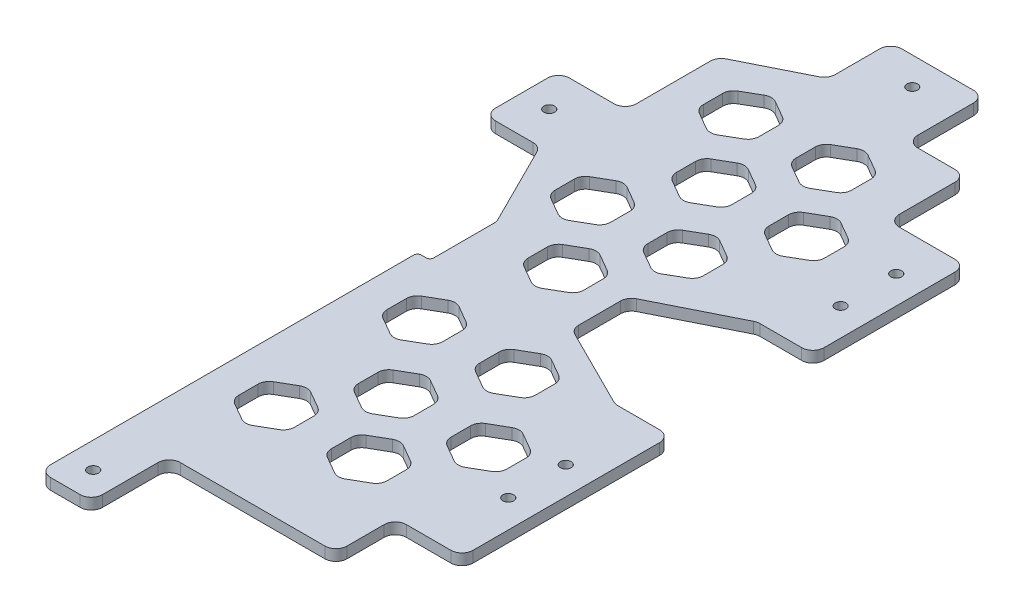
from build123d import *

# Parameters (mm, degrees)
EXTRUDE_1_DEPTH     = 3
FILLET_1_R          = 3
FILLET_2_R          = 1
SKETCH_2_R          = 1.45
CUT_EXTRUDE_1_DEPTH = 119.660324035
CUT_EXTRUDE_2_DEPTH = 119.660324035
FILLET_3_R          = 3


with BuildPart() as part:
    # 草图1 → 凸台-拉伸1 (new body)
    with BuildSketch(Plane(origin=(0, 0, 0), x_dir=(1, 0, 0), z_dir=(0, 1, 0))):
        Polygon((50.15, 65.5), (29.15, 65.5), (29.15, 86.5), (13.15, 86.5), (13.15, 107.5), (-12.15, 107.5), (-12.15, 90.645898034), (-32.15, 80.645898034), (-32.15, 55.854101966), (-50.15, 55.854101966), (-50.15, 35.854101966), (-35.15, 35.854101966), (-23.472949017, 12.5), (-23.472949017, -5.5), (-26.85, -5.5), (-26.85, -107.5), (-12.85, -107.5), (-12.85, -86.5), (32.15, -86.5), (32.15, -70.5), (50.15, -70.5), (50.15, -14.177050983), (35.15, -14.177050983), (11.795898034, -2.5), (11.795898034, 12.5), (35.15, 24.177050983), (50.15, 24.177050983), align=None)
    extrude(amount=EXTRUDE_1_DEPTH)

    # 圆角1
    fillet_1_edges = [part.edges().sort_by_distance(p)[0] for p in [
        (29.15, 1.5, -86.5),
        (29.15, 1.5, -65.5),
        (50.15, 1.5, -65.5),
        (50.15, 1.5, -24.177050983),
        (35.15, 1.5, -24.177050983),
        (11.795898034, 1.5, -12.5),
        (11.795898034, 1.5, 2.5),
        (35.15, 1.5, 14.177050983),
        (50.15, 1.5, 14.177050983),
        (50.15, 1.5, 70.5),
        (32.15, 1.5, 70.5),
        (32.15, 1.5, 86.5),
        (-12.85, 1.5, 86.5),
        (-12.85, 1.5, 107.5),
        (-26.85, 1.5, 107.5),
        (-23.472949017, 1.5, -12.5),
        (-35.15, 1.5, -35.854101966),
        (-50.15, 1.5, -35.854101966),
        (-50.15, 1.5, -55.854101966),
        (-32.15, 1.5, -55.854101966),
        (-32.15, 1.5, -80.645898034),
        (-12.15, 1.5, -90.645898034),
        (-12.15, 1.5, -107.5),
        (13.15, 1.5, -107.5),
        (13.15, 1.5, -86.5),
    ]]
    fillet(fillet_1_edges, radius=FILLET_1_R)

    # 圆角2
    fillet_2_edges = [part.edges().sort_by_distance(p)[0] for p in [
        (-26.85, 1.5, 5.5),
        (-23.472949017, 1.5, 5.5),
    ]]
    fillet(fillet_2_edges, radius=FILLET_2_R)

    # 草图2 → 切除-拉伸1 (cut, through all)
    with BuildSketch(Plane(origin=(0, 3, 0), x_dir=(1, 0, 0), z_dir=(0, 1, 0))):
        with Locations(Location((-19.85, -100, 0), (0, 0, 270))):
            Circle(SKETCH_2_R)
        with Locations(Location((42.65, -50.5, 0), (0, 0, 270))):
            Circle(SKETCH_2_R)
        with Locations(Location((42.65, -35, 0), (0, 0, 270))):
            Circle(SKETCH_2_R)
        with Locations(Location((-42.65, 45.854101966, 0), (0, 0, 270))):
            Circle(SKETCH_2_R)
        with Locations(Location((1.15, 100, 0), (0, 0, 270))):
            Circle(SKETCH_2_R)
        with Locations(Location((42.65, 54.177050983, 0), (0, 0, 270))):
            Circle(SKETCH_2_R)
        with Locations(Location((42.65, 39.177050983, 0), (0, 0, 270))):
            Circle(SKETCH_2_R)
    extrude(amount=-CUT_EXTRUDE_1_DEPTH, mode=Mode.SUBTRACT)

    # 草图3 → 切除-拉伸2 (cut, through all)
    with BuildSketch(Plane(origin=(0, 3, 0), x_dir=(1, 0, 0), z_dir=(0, 1, 0))):
        Polygon((9.571891676, 78.984769588), (2.071891676, 74.654642569), (2.071891676, 65.994388531), (9.571891676, 61.664261512), (17.071891676, 65.994388531), (17.071891676, 74.654642569), align=None)
        Polygon((-15.428108324, 78.984769588), (-22.928108324, 74.654642569), (-22.928108324, 65.994388531), (-15.428108324, 61.664261512), (-7.928108324, 65.994388531), (-7.928108324, 74.654642569), align=None)
        Polygon((4.294292085, 55.153136353), (-3.205707915, 59.483263372), (-10.705707915, 55.153136353), (-10.705707915, 46.492882315), (-3.205707915, 42.162755296), (4.294292085, 46.492882315), align=None)
        Polygon((29.294292085, 55.153136353), (21.794292085, 59.483263372), (14.294292085, 55.153136353), (14.294292085, 46.492882315), (21.794292085, 42.162755296), (29.294292085, 46.492882315), align=None)
        Polygon((9.571891676, 38.984769588), (2.071891676, 34.654642569), (2.071891676, 25.994388531), (9.571891676, 21.664261512), (17.071891676, 25.994388531), (17.071891676, 34.654642569), align=None)
        Polygon((-15.428108324, 38.984769588), (-22.928108324, 34.654642569), (-22.928108324, 25.994388531), (-15.428108324, 21.664261512), (-7.928108324, 25.994388531), (-7.928108324, 34.654642569), align=None)
        Polygon((4.294292085, 15.153136353), (-3.205707915, 19.483263372), (-10.705707915, 15.153136353), (-10.705707915, 6.492882315), (-3.205707915, 2.162755296), (4.294292085, 6.492882315), align=None)
        Polygon((22.311009352, -15.926625216), (14.811009352, -11.596498197), (7.311009352, -15.926625216), (7.311009352, -24.586879253), (14.811009352, -28.917006272), (22.311009352, -24.586879253), align=None)
        Polygon((-2.688990648, -15.926625216), (-10.188990648, -11.596498197), (-17.688990648, -15.926625216), (-17.688990648, -24.586879253), (-10.188990648, -28.917006272), (-2.688990648, -24.586879253), align=None)
        Polygon((3.225464677, -32.719172263), (-4.274535323, -37.049299282), (-4.274535323, -45.70955332), (3.225464677, -50.039680339), (10.725464677, -45.70955332), (10.725464677, -37.049299282), align=None)
        Polygon((28.225464677, -32.719172263), (20.725464677, -37.049299282), (20.725464677, -45.70955332), (28.225464677, -50.039680339), (35.725464677, -45.70955332), (35.725464677, -37.049299282), align=None)
        Polygon((22.311009352, -55.926625216), (14.811009352, -51.596498197), (7.311009352, -55.926625216), (7.311009352, -64.586879253), (14.811009352, -68.917006272), (22.311009352, -64.586879253), align=None)
        Polygon((-2.688990648, -55.926625216), (-10.188990648, -51.596498197), (-17.688990648, -55.926625216), (-17.688990648, -64.586879253), (-10.188990648, -68.917006272), (-2.688990648, -64.586879253), align=None)
    extrude(amount=-CUT_EXTRUDE_2_DEPTH, mode=Mode.SUBTRACT)

    # 圆角3
    fillet_3_edges = [part.edges().sort_by_distance(p)[0] for p in [
        (3.225464677, 1.5, 32.719172263),
        (10.725464677, 1.5, 37.049299282),
        (10.725464677, 1.5, 45.70955332),
        (3.225464677, 1.5, 50.039680339),
        (-4.274535323, 1.5, 45.70955332),
        (-4.274535323, 1.5, 37.049299282),
        (4.294292085, 1.5, -15.153136353),
        (4.294292085, 1.5, -6.492882315),
        (-3.205707915, 1.5, -2.162755296),
        (-10.705707915, 1.5, -6.492882315),
        (-10.705707915, 1.5, -15.153136353),
        (-3.205707915, 1.5, -19.483263372),
        (-15.428108324, 1.5, -38.984769588),
        (-7.928108324, 1.5, -34.654642569),
        (-7.928108324, 1.5, -25.994388531),
        (-15.428108324, 1.5, -21.664261512),
        (-22.928108324, 1.5, -25.994388531),
        (-22.928108324, 1.5, -34.654642569),
        (9.571891676, 1.5, -38.984769588),
        (17.071891676, 1.5, -34.654642569),
        (17.071891676, 1.5, -25.994388531),
        (9.571891676, 1.5, -21.664261512),
        (2.071891676, 1.5, -25.994388531),
        (2.071891676, 1.5, -34.654642569),
        (4.294292085, 1.5, -55.153136353),
        (4.294292085, 1.5, -46.492882315),
        (-3.205707915, 1.5, -42.162755296),
        (-10.705707915, 1.5, -46.492882315),
        (-10.705707915, 1.5, -55.153136353),
        (-3.205707915, 1.5, -59.483263372),
        (-2.688990648, 1.5, 15.926625216),
        (-2.688990648, 1.5, 24.586879253),
        (-10.188990648, 1.5, 28.917006272),
        (-17.688990648, 1.5, 24.586879253),
        (-17.688990648, 1.5, 15.926625216),
        (-10.188990648, 1.5, 11.596498197),
        (9.571891676, 1.5, -78.984769588),
        (17.071891676, 1.5, -74.654642569),
        (17.071891676, 1.5, -65.994388531),
        (9.571891676, 1.5, -61.664261512),
        (2.071891676, 1.5, -65.994388531),
        (2.071891676, 1.5, -74.654642569),
        (29.294292085, 1.5, -55.153136353),
        (29.294292085, 1.5, -46.492882315),
        (21.794292085, 1.5, -42.162755296),
        (14.294292085, 1.5, -46.492882315),
        (14.294292085, 1.5, -55.153136353),
        (21.794292085, 1.5, -59.483263372),
        (22.311009352, 1.5, 15.926625216),
        (22.311009352, 1.5, 24.586879253),
        (14.811009352, 1.5, 28.917006272),
        (7.311009352, 1.5, 24.586879253),
        (7.311009352, 1.5, 15.926625216),
        (14.811009352, 1.5, 11.596498197),
        (28.225464677, 1.5, 32.719172263),
        (35.725464677, 1.5, 37.049299282),
        (35.725464677, 1.5, 45.70955332),
        (28.225464677, 1.5, 50.039680339),
        (20.725464677, 1.5, 45.70955332),
        (20.725464677, 1.5, 37.049299282),
        (22.311009352, 1.5, 55.926625216),
        (22.311009352, 1.5, 64.586879253),
        (14.811009352, 1.5, 68.917006272),
        (7.311009352, 1.5, 64.586879253),
        (7.311009352, 1.5, 55.926625216),
        (14.811009352, 1.5, 51.596498197),
        (-2.688990648, 1.5, 55.926625216),
        (-2.688990648, 1.5, 64.586879253),
        (-10.188990648, 1.5, 68.917006272),
        (-17.688990648, 1.5, 64.586879253),
        (-17.688990648, 1.5, 55.926625216),
        (-10.188990648, 1.5, 51.596498197),
        (-15.428108324, 1.5, -78.984769588),
        (-7.928108324, 1.5, -74.654642569),
        (-7.928108324, 1.5, -65.994388531),
        (-15.428108324, 1.5, -61.664261512),
        (-22.928108324, 1.5, -65.994388531),
        (-22.928108324, 1.5, -74.654642569),
    ]]
    fillet(fillet_3_edges, radius=FILLET_3_R)


solid = part.part
